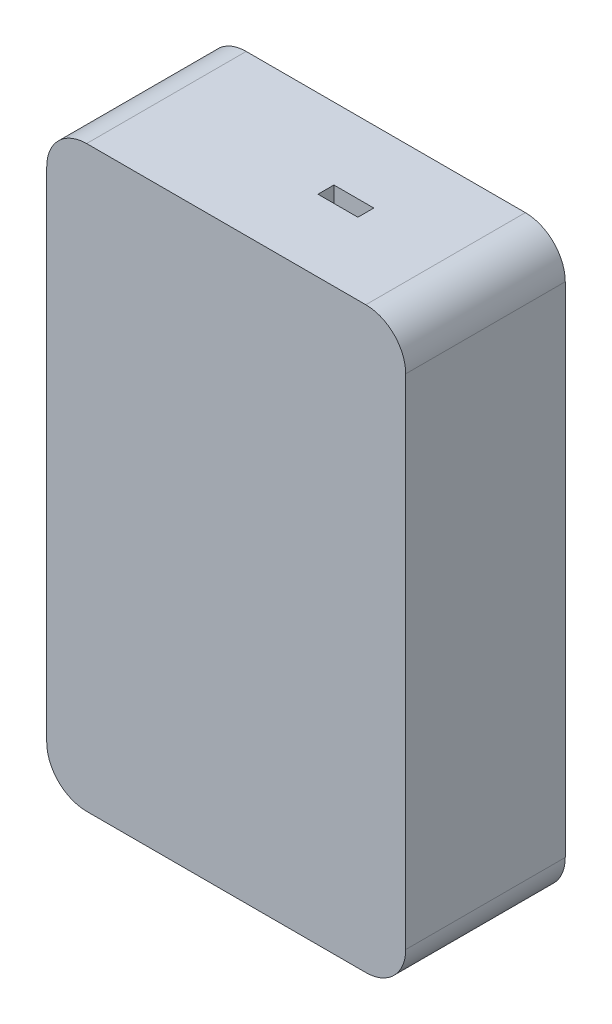
from build123d import *

# Parameters (mm, degrees)
BOSS_EXTRUDE2_DEPTH             = 65
BOSS_EXTRUDE2_DEPTH_BACK        = 65
SKETCH1_W                       = 90
SKETCH1_H                       = 40
SKETCH1_W_2                     = 75
SKETCH1_H_2                     = 25
SKETCH2_W                       = 90
SKETCH2_H                       = 40
BOSS_EXTRUDE3_DEPTH             = 7.5
CUT_EXTRUDE1_REACH              = 155.134
SKETCH3_R                       = 6.5
BOSS_EXTRUDE4_DEPTH             = 10
BOSS_EXTRUDE4_DEPTH_BACK        = 10
SKETCH6_W                       = 70
SKETCH6_H                       = 70
BOSS_EXTRUDE4_2_DEPTH           = 10
BOSS_EXTRUDE4_2_DEPTH_BACK      = 10
SKETCH6_W_2                     = 54.7
SKETCH6_H_2                     = 41
BOSS_EXTRUDE5_REACH             = 89.643
SKETCH7_W                       = 65
SKETCH7_H                       = 9
BOSS_EXTRUDE5_DIRECTION_2_REACH = 89.643
CUT_EXTRUDE2_DEPTH              = 2
CUT_EXTRUDE2_DEPTH_BACK         = 2
SKETCH9_W                       = 10
SKETCH9_H                       = 7.5
SKETCH9_W_2                     = 7.5
SKETCH9_H_2                     = 10
FILLET1_R                       = 10
FILLET2_R                       = 3


with BuildPart() as part:
    # Sketch1 → Boss-Extrude2 (new, two sides: drawn at the far end of the back side and taken through both)
    with BuildSketch(Plane(origin=(0, 0, 0), x_dir=(1, 0, 0), z_dir=(0, 1, 0)).offset(-BOSS_EXTRUDE2_DEPTH_BACK)):
        Rectangle(SKETCH1_W, SKETCH1_H)
        Rectangle(SKETCH1_W_2, SKETCH1_H_2, mode=Mode.SUBTRACT)
    extrude(amount=BOSS_EXTRUDE2_DEPTH + BOSS_EXTRUDE2_DEPTH_BACK)

    # Sketch2 → Boss-Extrude3 (add)
    with BuildSketch(Plane.XZ.offset(65)):
        Rectangle(SKETCH2_W, SKETCH2_H)
    boss_extrude3 = extrude(amount=BOSS_EXTRUDE3_DEPTH)

    # Mirror1: Boss-Extrude3 across plane
    add(boss_extrude3.mirror(Plane.ZX))

    # Sketch3 → Cut-Extrude1 (cut, up to next)
    with BuildSketch(Plane.XZ.offset(72.5), mode=Mode.PRIVATE) as cut_extrude1_sk1:
        with Locations((-20, 0)):
            Circle(SKETCH3_R)
    cut_extrude1_tool1 = extrude(cut_extrude1_sk1.sketch, amount=-CUT_EXTRUDE1_REACH, mode=Mode.PRIVATE) & part.part
    add(cut_extrude1_tool1.solids().sort_by_distance((-20, -72.5, 0))[0], mode=Mode.SUBTRACT)

    # Sketch7 → Boss-Extrude5 (add, up to next)
    with BuildSketch(Plane.XY, mode=Mode.PRIVATE) as boss_extrude5_sk1:
        with Locations((-5, -14.5)):
            Rectangle(SKETCH7_W, SKETCH7_H)
    boss_extrude5_tool1 = extrude(boss_extrude5_sk1.sketch, amount=BOSS_EXTRUDE5_REACH, mode=Mode.PRIVATE) - part.part
    add(boss_extrude5_tool1.solids().sort_by_distance((-5, -14.5, 0))[0])

    # Sketch7 → Boss-Extrude5 direction 2 (add, up to next)
    with BuildSketch(Plane.XY, mode=Mode.PRIVATE) as boss_extrude5_direction_2_sk1:
        with Locations((-5, -14.5)):
            Rectangle(SKETCH7_W, SKETCH7_H)
    boss_extrude5_direction_2_tool1 = extrude(boss_extrude5_direction_2_sk1.sketch, amount=-BOSS_EXTRUDE5_DIRECTION_2_REACH, mode=Mode.PRIVATE) - part.part
    add(boss_extrude5_direction_2_tool1.solids().sort_by_distance((-5, -14.5, 0))[0])

    # Sketch9 → Cut-Extrude2 (cut, two sides: drawn at the far end of the back side and taken through both)
    with BuildSketch(Plane.XY.offset(-CUT_EXTRUDE2_DEPTH_BACK)):
        with Locations((10, 68.75)):
            Rectangle(SKETCH9_W, SKETCH9_H)
        with Locations((-41.25, 5)):
            Rectangle(SKETCH9_W_2, SKETCH9_H_2)
    extrude(amount=CUT_EXTRUDE2_DEPTH + CUT_EXTRUDE2_DEPTH_BACK, mode=Mode.SUBTRACT)

    # Fillet1
    fillet1_edges = [part.edges().sort_by_distance(p)[0] for p in [
        (-45, 72.5, 0),
        (-45, -72.5, 0),
        (45, -72.5, 0),
        (45, 72.5, 0),
    ]]
    fillet(fillet1_edges, radius=FILLET1_R)

    # Fillet2
    fillet2_edges = [part.edges().sort_by_distance(p)[0] for p in [
        (27.5, -19, 0),
        (27.5, -10, 0),
    ]]
    fillet(fillet2_edges, radius=FILLET2_R)


with BuildPart() as body_2:
    # Sketch6 → Boss-Extrude4 (new, two sides: drawn at the far end of the back side and taken through both)
    with BuildSketch(Plane.XY.offset(-BOSS_EXTRUDE4_DEPTH_BACK)):
        with Locations((0, 27.5)):
            Rectangle(SKETCH6_W, SKETCH6_H)
    extrude(amount=BOSS_EXTRUDE4_DEPTH + BOSS_EXTRUDE4_DEPTH_BACK)


with BuildPart() as body_3:
    # Sketch6 → Boss-Extrude4 2 (new, two sides: drawn at the far end of the back side and taken through both)
    with BuildSketch(Plane.XY.offset(-BOSS_EXTRUDE4_2_DEPTH_BACK)):
        with Locations((-7.65, -42)):
            Rectangle(SKETCH6_W_2, SKETCH6_H_2)
    extrude(amount=BOSS_EXTRUDE4_2_DEPTH + BOSS_EXTRUDE4_2_DEPTH_BACK)


solid = Compound([part.part, body_2.part, body_3.part])
